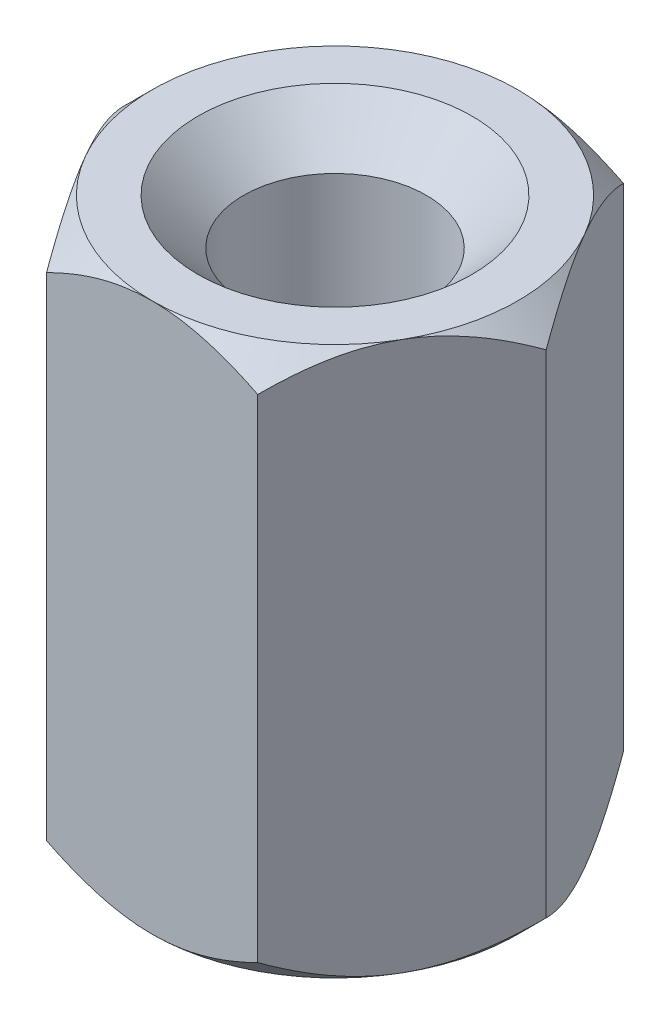
from build123d import *

# Parameters (mm, degrees)
EXTRUDE1_DEPTH = 6


with BuildPart() as part:
    # Sketch1 → Extrude1 (new body)
    with BuildSketch(Plane(origin=(0, 0, 0), x_dir=(1, 0, 0), z_dir=(0, 1, 0))):
        Polygon((1.154700538, 2), (-1.154700538, 2), (-2.309401077, 0), (-1.154700538, -2), (1.154700538, -2), (2.309401077, 0), align=None)
    extrude(amount=EXTRUDE1_DEPTH)

    # Sketch3 → Cut-Revolve1 (revolve, cut)
    with BuildSketch(Plane(origin=(0, 0, 0), x_dir=(0, 0, -1), z_dir=(1, 0, 0)), mode=Mode.PRIVATE) as cut_revolve1_sk:
        Polygon((1.5, 6), (1, 5.5), (1, 0.5), (1.5, 0), (0, 0), (0, 6), align=None)
    revolve(cut_revolve1_sk.sketch.rotate(Axis((0, 6, 0), (0, -1, 0)), 180), axis=Axis((0, 6, 0), (0, -1, 0)), mode=Mode.SUBTRACT)

    # Sketch4 → Cut-Revolve3 (revolve, cut)
    with BuildSketch(Plane(origin=(0, 0, 0), x_dir=(0, 0, -1), z_dir=(1, 0, 0))):
        Polygon((2, 6), (4.5, 6), (4.5, 3.5), align=None)
        Polygon((2, 0), (4.5, 0), (4.5, 2.5), align=None)
    revolve(axis=Axis((0, 0, 0), (0, 1, 0)), mode=Mode.SUBTRACT)


solid = part.part
